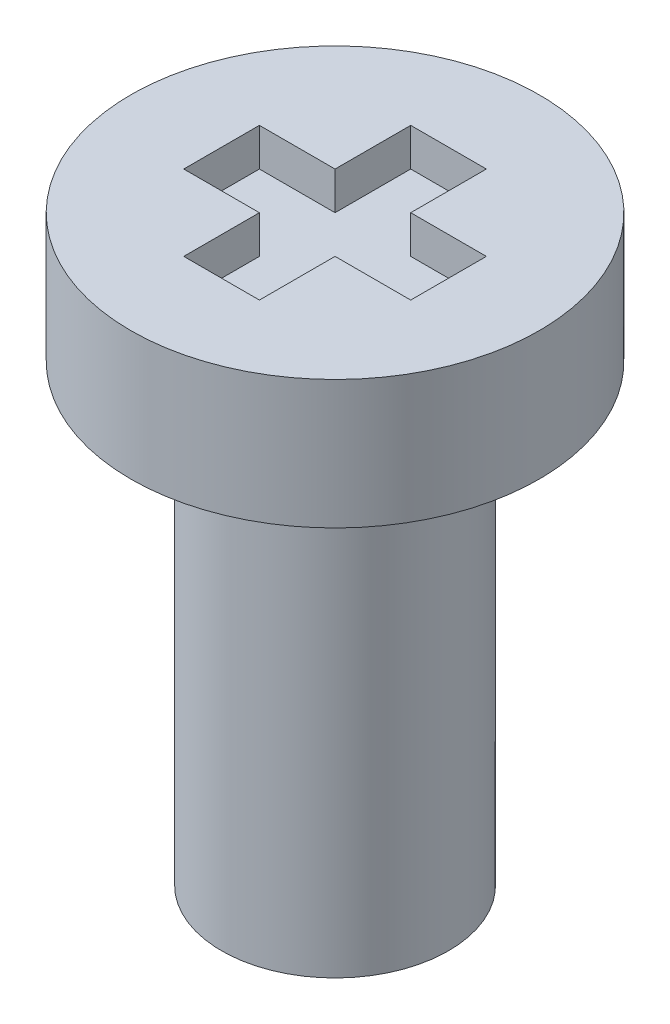
from build123d import *

# Parameters (mm, degrees)
SKETCH_1_R          = 2.7
EXTRUDE_1_DEPTH     = 1.7
CUT_EXTRUDE_1_DEPTH = 0.5
SKETCH_3_R          = 1.5
EXTRUDE_2_DEPTH     = 6


with BuildPart() as part:
    # 草图1 → 凸台-拉伸1 (new body)
    with BuildSketch(Plane(origin=(0, 0, 0), x_dir=(1, 0, 0), z_dir=(0, 1, 0))):
        with Locations(Location((0, 0, 0), (0, 0, 270))):
            Circle(SKETCH_1_R)
    extrude(amount=EXTRUDE_1_DEPTH)

    # 草图2 → 切除-拉伸1 (cut)
    with BuildSketch(Plane(origin=(0, 1.7, 0), x_dir=(1, 0, 0), z_dir=(0, 1, 0))):
        Polygon((0, 1.5), (0.5, 1.5), (0.5, 0.5), (1.5, 0.5), (1.5, 0), (1.5, -0.5), (0.5, -0.5), (0.5, -1.5), (0, -1.5), (-0.5, -1.5), (-0.5, -0.5), (-1.5, -0.5), (-1.5, 0), (-1.5, 0.5), (-0.5, 0.5), (-0.5, 1.5), align=None)
    extrude(amount=-CUT_EXTRUDE_1_DEPTH, mode=Mode.SUBTRACT)

    # 草图3 → 凸台-拉伸2 (add)
    with BuildSketch(Plane.XZ):
        with Locations(Location((0, 0, 0), (0, 0, 270))):
            Circle(SKETCH_3_R)
    extrude(amount=EXTRUDE_2_DEPTH)


solid = part.part
